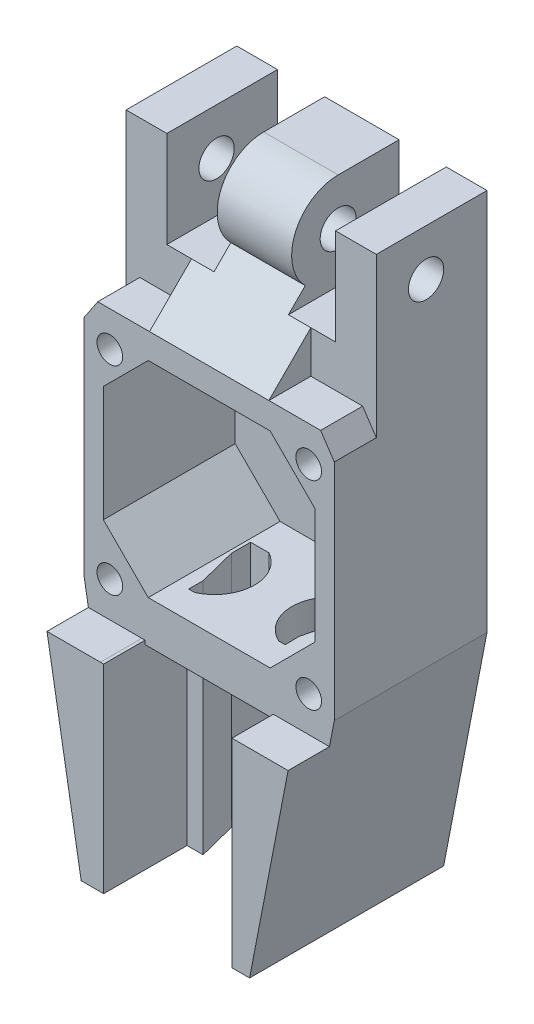
from build123d import *

# Parameters (mm, degrees)
SKETCH1_W                = 26
SKETCH1_H                = 28
BOSS_EXTRUDE1_DEPTH      = 50
CUT_EXTRUDE3_DEPTH       = 39
SKETCH14_R               = 7.25
BOSS_EXTRUDE7_DEPTH      = 5.8
SKETCH15_R               = 2.8
CUT_EXTRUDE4_DEPTH       = 28
CUT_EXTRUDE7_DEPTH       = 54.29223677
SKETCH19_R               = 2.15
CUT_EXTRUDE9_DEPTH       = 50
SKETCH20_R               = 4
CUT_EXTRUDE10_DEPTH      = 3
ESQUISSE1_W              = 17.371158736
ESQUISSE1_H              = 10.855066753
ENL_V_MAT_EXTRU_1_DEPTH  = 7.5
ESQUISSE2_R              = 1.7
ENL_V_MAT_EXTRU_2_DEPTH  = 7.5
ENL_V_START              = -7.2
ESQUISSE3_W              = 17.25
ESQUISSE3_H              = 8.423951408
ENL_V_MAT_EXTRU_3_DEPTH  = 7.2
ESQUISSE4_W              = 39
ESQUISSE4_H              = 42
BOSS_EXTRU_2_DEPTH       = 17.25
ESQUISSE5_W              = 29.115254442
ESQUISSE5_H              = 34.676509426
ENL_V_MAT_EXTRU_4_DEPTH  = 19
ESQUISSE6_R              = 3
ENL_V_MAT_EXTRU_5_DEPTH  = 19
ESQUISSE7_R              = 9.530246906
ENL_V_MAT_EXTRU_6_DEPTH  = 14
ENL_V_MAT_EXTRU_7_DEPTH  = 14
ESQUISSE10_W             = 39
ESQUISSE10_H             = 17.25
BOSS_EXTRU_5_DEPTH       = 31
ENL_V_MAT_EXTRU_9_DEPTH  = 32
ENL_V_START_2            = -17.25
ESQUISSE16_R             = 2
ENL_V_MAT_EXTRU_11_DEPTH = 17.25
ESQUISSE17_R             = 2.75
ENL_V_MAT_EXTRU_12_DEPTH = 9
ESQUISSE27_W             = 21
ESQUISSE27_H             = 3
BOSS_EXTRU_24_DEPTH      = 6.55
BOSS_EXTRU_7_DEPTH       = 17.25
ENL_V_MAT_EXTRU_14_DEPTH = 17.3
ENL_V_MAT_EXTRU_16_DEPTH = 17.25
ENL_V_MAT_EXTRU_38_DEPTH = 11
ENL_V_MAT_EXTRU_39_DEPTH = 5
BOSS_EXTRU_30_DEPTH      = 0.6
ESQUISSE45_R             = 2.15
ENL_V_MAT_EXTRU_40_DEPTH = 9
ESQUISSE40_R             = 2
BOSS_EXTRU_37_DEPTH      = 6.55
BOSS_EXTRU_35_DEPTH      = 17.25
BOSS_EXTRU_36_DEPTH      = 17.25
ESQUISSE50_R             = 2.75
ENL_V_MAT_EXTRU_42_DEPTH = 49
ESQUISSE52_W             = 15.002829597
ESQUISSE52_H             = 3.6
BOSS_EXTRU_38_DEPTH      = 6.55
ENL_V_START_3            = -10
ENL_V_MAT_EXTRU_43_DEPTH = 10
BOSS_EXTRU_39_DEPTH      = 13
ESQUISSE55_W             = 21
ESQUISSE55_H             = 0.60000033
BOSS_EXTRU_40_DEPTH      = 6.45
ESQUISSE61_W             = 20
ESQUISSE61_H             = 3.13607345
ENL_V_MAT_EXTRU_44_DEPTH = 6.45
BOSS_EXTRU_41_DEPTH      = 6.55


with BuildPart() as part:
    # Sketch1 → Boss-Extrude1 (new body)
    with BuildSketch(Plane(origin=(0, 0, 0), x_dir=(1, 0, 0), z_dir=(0, 1, 0))):
        Rectangle(SKETCH1_W, SKETCH1_H)
    extrude(amount=BOSS_EXTRUDE1_DEPTH)

    # Sketch7 → Cut-Extrude3 (cut)
    with BuildSketch(Plane(origin=(13, 0, 0), x_dir=(0, 0, -1), z_dir=(1, 0, 0))):
        with BuildLine():
            Line((4.5, 50), (-14, 50))
            Line((-14, 50), (-14, 24))
            Line((-14, 24), (-0.626524164, 37.373475836))
            ThreePointArc((-0.626524164, 37.373475836), (11.198126611, 39.725545115), (4.5, 49.75))
            Line((4.5, 49.75), (14, 49.75))
            Line((14, 49.75), (14, 50))
            Line((14, 50), (4.5, 50))
        make_face()
    extrude(amount=-CUT_EXTRUDE3_DEPTH, mode=Mode.SUBTRACT)

    # Sketch14 → Boss-Extrude7 (add, symmetric)
    with BuildSketch(Plane(origin=(0, 0, 0), x_dir=(0, 0, -1), z_dir=(1, 0, 0))):
        with Locations((4.5, 42.5)):
            Circle(SKETCH14_R)
    boss_extrude7 = extrude(amount=BOSS_EXTRUDE7_DEPTH, both=True)

    # Symétrie1: Boss-Extrude7 across plane
    add(boss_extrude7.mirror(Plane(origin=(0, 0, 0), x_dir=(0, 0, 1), z_dir=(1, 0, 0))))

    # Sketch15 → Cut-Extrude4 (cut)
    with BuildSketch(Plane(origin=(13, 0, 0), x_dir=(0, 0, -1), z_dir=(1, 0, 0))):
        with Locations((4.5, 42.5)):
            Circle(SKETCH15_R)
    extrude(amount=-CUT_EXTRUDE4_DEPTH, mode=Mode.SUBTRACT)

    # Sketch17 → Cut-Extrude7 (cut, through all)
    with BuildSketch(Plane.XZ):
        Polygon((-9.3, 3.25), (-13, 3.25), (-13, 14), (13, 14), (13, 3.25), (9.3, 3.25), (9.3, 9.8), (-9.3, 9.8), align=None)
    extrude(amount=-CUT_EXTRUDE7_DEPTH, mode=Mode.SUBTRACT)

    # Sketch19 → Cut-Extrude9 (cut)
    with BuildSketch(Plane(origin=(0, 0, -14), x_dir=(-1, 0, 0), z_dir=(0, 0, -1))):
        with Locations((0, 15)):
            Circle(SKETCH19_R)
    extrude(amount=-CUT_EXTRUDE9_DEPTH, mode=Mode.SUBTRACT)

    # Sketch20 → Cut-Extrude10 (cut)
    with BuildSketch(Plane(origin=(0, 0, -14), x_dir=(-1, 0, 0), z_dir=(0, 0, -1))):
        with Locations((0, 15)):
            Circle(SKETCH20_R)
    extrude(amount=-CUT_EXTRUDE10_DEPTH, mode=Mode.SUBTRACT)

    # Esquisse1 → Enlèv. mat.-Extru.1 (cut)
    with BuildSketch(Plane(origin=(0, 49.75, 0), x_dir=(1, 0, 0), z_dir=(0, 1, 0))):
        with Locations((-14.485579368, 9.927533377)):
            Rectangle(ESQUISSE1_W, ESQUISSE1_H)
    enl_v_mat_extru_1 = extrude(amount=-ENL_V_MAT_EXTRU_1_DEPTH, mode=Mode.SUBTRACT)

    # Symétrie3: Enlèv. mat.-Extru.1 across plane
    add(enl_v_mat_extru_1.mirror(Plane(origin=(0, 0, 0), x_dir=(0, 0, 1), z_dir=(1, 0, 0))), mode=Mode.SUBTRACT)

    # Esquisse2 → Enlèv. mat.-Extru.2 (cut)
    with BuildSketch(Plane.ZY.offset(13)):
        with Locations((-8, 14.2)):
            Circle(ESQUISSE2_R)
        with Locations((-3, 5.2)):
            Circle(ESQUISSE2_R)
    enl_v_mat_extru_2 = extrude(amount=-ENL_V_MAT_EXTRU_2_DEPTH, mode=Mode.SUBTRACT)

    # Symétrie2: Enlèv. mat.-Extru.2 across plane
    add(enl_v_mat_extru_2.mirror(Plane(origin=(0, 0, 0), x_dir=(0, 0, 1), z_dir=(1, 0, 0))), mode=Mode.SUBTRACT)

    # Esquisse3 → Enlèv. mat.-Extru.3 (cut)
    with BuildSketch(Plane(origin=(13, 0, 0), x_dir=(0, 0, -1), z_dir=(1, 0, 0)).offset(ENL_V_START)):
        with Locations((5.375, 38.961975704)):
            Rectangle(ESQUISSE3_W, ESQUISSE3_H)
    enl_v_mat_extru_3 = extrude(amount=ENL_V_MAT_EXTRU_3_DEPTH, mode=Mode.SUBTRACT)

    # Symétrie4: Enlèv. mat.-Extru.3 across plane
    add(enl_v_mat_extru_3.mirror(Plane(origin=(0, 0, 0), x_dir=(0, 0, 1), z_dir=(1, 0, 0))), mode=Mode.SUBTRACT)

    # Esquisse4 → Boss.-Extru.2 (add)
    with BuildSketch(Plane.XY.offset(3.25)):
        with Locations((0, 7.2)):
            Rectangle(ESQUISSE4_W, ESQUISSE4_H)
    extrude(amount=-BOSS_EXTRU_2_DEPTH)

    # Esquisse5 → Enlèv. mat.-Extru.4 (cut)
    with BuildSketch(Plane.XY.offset(3.25)):
        with Locations((1.557627221, 10.861745287)):
            Rectangle(ESQUISSE5_W, ESQUISSE5_H)
    extrude(amount=ENL_V_MAT_EXTRU_4_DEPTH, mode=Mode.SUBTRACT)

    # Esquisse6 → Enlèv. mat.-Extru.5 (cut)
    with BuildSketch(Plane.XY.offset(3.25)):
        with Locations((0, 7.2)):
            Circle(ESQUISSE6_R)
    extrude(amount=-ENL_V_MAT_EXTRU_5_DEPTH, mode=Mode.SUBTRACT)

    # Esquisse7 → Enlèv. mat.-Extru.6 (cut)
    with BuildSketch(Plane.XY.offset(3.25)):
        with Locations((0, 7.2)):
            Circle(ESQUISSE7_R)
    extrude(amount=-ENL_V_MAT_EXTRU_6_DEPTH, mode=Mode.SUBTRACT)

    # Esquisse8 → Enlèv. mat.-Extru.7 (cut)
    with BuildSketch(Plane.XY.offset(3.25)):
        Polygon((-9.5, 24.2), (9.5, 24.2), (16.5, 17.2), (16.5, -0.8), (9.5, -7.8), (-9.5, -7.8), (-16.5, -0.8), (-16.5, 17.2), align=None)
    extrude(amount=-ENL_V_MAT_EXTRU_7_DEPTH, mode=Mode.SUBTRACT)

    # Esquisse10 → Boss.-Extru.5 (add)
    with BuildSketch(Plane.XZ.offset(13.8)):
        with Locations((0, -5.375)):
            Rectangle(ESQUISSE10_W, ESQUISSE10_H)
    extrude(amount=BOSS_EXTRU_5_DEPTH)

    # Sketch3 → Enlèv. mat.-Extru.9 (cut)
    with BuildSketch(Plane(origin=(0, -13.8, 0), x_dir=(1, 0, 0), z_dir=(0, 1, 0))):
        Polygon((10, 2.65), (10, 9.65), (2.9, 9.65), (2.9, 5.65), (-2.9, 5.65), (-2.9, 9.65), (-10, 9.65), (-10, 2.65), (-9, 2.65), (-7.502829597, -3.25), (-10, -3.25), (-10, -14.961698536), (10, -14.961698536), (10, -3.25), (7.5, -3.25), (9, 2.65), align=None)
    extrude(amount=-ENL_V_MAT_EXTRU_9_DEPTH, mode=Mode.SUBTRACT)

    # Esquisse16 → Enlèv. mat.-Extru.11 (cut)
    with BuildSketch(Plane.XY.offset(3.25).offset(ENL_V_START_2)):
        with Locations((15.512108792, 22.7)):
            Circle(ESQUISSE16_R)
        with Locations((-15.487891208, 22.7)):
            Circle(ESQUISSE16_R)
        with Locations((15.512108792, -8.3)):
            Circle(ESQUISSE16_R)
        with Locations((-15.487891208, -8.3)):
            Circle(ESQUISSE16_R)
    extrude(amount=ENL_V_MAT_EXTRU_11_DEPTH, mode=Mode.SUBTRACT)

    # Esquisse17 → Enlèv. mat.-Extru.12 (cut)
    with BuildSketch(Plane(origin=(0, 0, -14), x_dir=(-1, 0, 0), z_dir=(0, 0, -1))):
        with Locations((-15.512108792, 22.7)):
            Circle(ESQUISSE17_R)
        with Locations((15.487891208, 22.7)):
            Circle(ESQUISSE17_R)
        with Locations((-15.512108792, -8.3)):
            Circle(ESQUISSE17_R)
        with Locations((15.487891208, -8.3)):
            Circle(ESQUISSE17_R)
    extrude(amount=-ENL_V_MAT_EXTRU_12_DEPTH, mode=Mode.SUBTRACT)

    # Esquisse27 → Boss.-Extru.24 (add)
    with BuildSketch(Plane.XY.offset(3.25)):
        with Locations((0, -12.9)):
            Rectangle(ESQUISSE27_W, ESQUISSE27_H)
    extrude(amount=BOSS_EXTRU_24_DEPTH)

    # Esquisse19 → Boss.-Extru.7 (add)
    with BuildSketch(Plane.XY.offset(3.25)):
        Polygon((-13, 34.75), (-19.5, 28.2), (-13, 28.2), align=None)
        Polygon((13, 34.75), (19.5, 28.2), (13, 28.2), align=None)
    extrude(amount=-BOSS_EXTRU_7_DEPTH)

    # Esquisse20 → Enlèv. mat.-Extru.14 (cut)
    with BuildSketch(Plane.XY.offset(3.25)):
        Polygon((-13, 34.75), (-19.5, 25), (-25.267044085, 25), (-36.830319762, 37.531631788), align=None)
    enl_v_mat_extru_14 = extrude(amount=-ENL_V_MAT_EXTRU_14_DEPTH, mode=Mode.SUBTRACT)

    # Symétrie5: Enlèv. mat.-Extru.14 across plane
    add(enl_v_mat_extru_14.mirror(Plane(origin=(0, 0, 0), x_dir=(0, 0, 1), z_dir=(1, 0, 0))), mode=Mode.SUBTRACT)

    # Esquisse23 → Enlèv. mat.-Extru.16 (cut)
    with BuildSketch(Plane.XY.offset(3.25).offset(ENL_V_START_2)):
        Polygon((-19.5, -9.9), (-13.501414798, -44.8), (-19.5, -53.715016997), (-34.841721145, -40.42179861), align=None)
        Polygon((19.5, -9.9), (12.75, -44.8), (15.434620089, -57.994993548), (31.637048755, -53.482911652), align=None)
    extrude(amount=ENL_V_MAT_EXTRU_16_DEPTH, mode=Mode.SUBTRACT)

    # Esquisse36 → Enlèv. mat.-Extru.38 (cut)
    with BuildSketch(Plane.XZ.offset(7.8)):
        with BuildLine():
            Line((9, -2.65), (9, -5.65))
            Line((9, -5.65), (6.149863907, -5.65))
            ThreePointArc((6.149863907, -5.65), (2.904031499, 0.044057116), (6.550876644, 5.489994589))
            Line((6.550876644, 5.489994589), (6.93050985, 5.489994589))
            Line((6.93050985, 5.489994589), (9, -2.65))
        make_face()
        with BuildLine():
            Line((-6.149863907, -5.65), (-9, -5.65))
            Line((-9, -5.65), (-9, -2.65))
            Line((-9, -2.65), (-6.934413732, 5.489994589))
            Line((-6.934413732, 5.489994589), (-6.550876644, 5.489994589))
            ThreePointArc((-6.550876644, 5.489994589), (-2.904031499, 0.044057116), (-6.149863907, -5.65))
        make_face()
    extrude(amount=ENL_V_MAT_EXTRU_38_DEPTH, mode=Mode.SUBTRACT)

    # Esquisse43 → Enlèv. mat.-Extru.39 (cut)
    with BuildSketch(Plane(origin=(0, -14.4, 0), x_dir=(-1, 0, 0), z_dir=(0, -1, 0))):
        Polygon((-6.93050985, -5.489994589), (-7.533514539, -5.489994589), (-7.5, -3.25), align=None)
        Polygon((7.502829597, -3.25), (7.502829597, -5.489994589), (6.934413732, -5.489994589), align=None)
    extrude(amount=-ENL_V_MAT_EXTRU_39_DEPTH, mode=Mode.SUBTRACT)

    # Esquisse44 → Boss.-Extru.30 (add)
    with BuildSketch(Plane.XZ.offset(13.8)):
        with BuildLine():
            Line((-9, -5.65), (-6.149863907, -5.65))
            ThreePointArc((-6.149863907, -5.65), (-3.085212662, -1.687593328), (-3.929562121, 3.25))
            Line((-3.929562121, 3.25), (3.929562121, 3.25))
            ThreePointArc((3.929562121, 3.25), (3.085212662, -1.687593328), (6.149863907, -5.65))
            Line((6.149863907, -5.65), (9, -5.65))
            Line((9, -5.65), (9, -2.65))
            Line((9, -2.65), (10, -2.65))
            Line((10, -2.65), (10, -9.65))
            Line((10, -9.65), (2.9, -9.65))
            Line((2.9, -9.65), (2.9, -5.65))
            Line((2.9, -5.65), (-2.9, -5.65))
            Line((-2.9, -5.65), (-2.9, -9.65))
            Line((-2.9, -9.65), (-10, -9.65))
            Line((-10, -9.65), (-10, -2.65))
            Line((-10, -2.65), (-9, -2.65))
            Line((-9, -2.65), (-9, -5.65))
        make_face()
    extrude(amount=BOSS_EXTRU_30_DEPTH)

    # Esquisse45 → Enlèv. mat.-Extru.40 (cut)
    with BuildSketch(Plane.XY.offset(-5.65)):
        with Locations((0, -24.4)):
            Circle(ESQUISSE45_R)
    extrude(amount=-ENL_V_MAT_EXTRU_40_DEPTH, mode=Mode.SUBTRACT)

    # Esquisse40 → Boss.-Extru.37 (add)
    with BuildSketch(Plane.XY.offset(3.25)):
        Polygon((17.36666519, 28.200002216), (-17.36666519, 28.200002216), (-19.5, 25), (-19.5, -9.9), (-19.242181152, -11.4), (-10.5, -11.4), (-7.502829597, -11.4), (-7.502829597, -7.8), (-9.5, -7.8), (-16.5, -0.8), (-16.5, 17.2), (-9.5, 24.2), (9.5, 24.2), (16.5, 17.2), (16.5, -0.8), (9.5, -7.8), (7.5, -7.8), (7.5, -11.4), (10.5, -11.4), (19.209885387, -11.4), (19.5, -9.9), (19.5, 25), align=None)
        with Locations((-15.487891208, 22.7)):
            Circle(ESQUISSE40_R, mode=Mode.SUBTRACT)
        with Locations((-15.487891208, -8.3)):
            Circle(ESQUISSE40_R, mode=Mode.SUBTRACT)
        with Locations((15.512108792, -8.3)):
            Circle(ESQUISSE40_R, mode=Mode.SUBTRACT)
        with Locations((15.512108792, 22.7)):
            Circle(ESQUISSE40_R, mode=Mode.SUBTRACT)
    extrude(amount=BOSS_EXTRU_37_DEPTH)

    # Esquisse48 → Boss.-Extru.35 (add)
    with BuildSketch(Plane.XY.offset(3.25)):
        Polygon((13.15, 34.75), (13.15, 49.75), (19.5, 49.75), (19.5, 25), (13, 34.75), align=None)
    extrude(amount=-BOSS_EXTRU_35_DEPTH)

    # Esquisse51 → Boss.-Extru.36 (add)
    with BuildSketch(Plane.XY.offset(3.25)):
        Polygon((-19.5, 25), (-19.5, 49.75), (-13.15, 49.75), (-13.15, 34.75), (-13, 34.75), align=None)
    extrude(amount=-BOSS_EXTRU_36_DEPTH)

    # Esquisse50 → Enlèv. mat.-Extru.42 (cut)
    with BuildSketch(Plane(origin=(19.5, 0, 0), x_dir=(0, 0, -1), z_dir=(1, 0, 0))):
        with Locations(Location((4.5, 42.5, 0), (0, 0, 90))):
            Circle(ESQUISSE50_R)
    extrude(amount=-ENL_V_MAT_EXTRU_42_DEPTH, mode=Mode.SUBTRACT)

    # Esquisse52 → Boss.-Extru.38 (add)
    with BuildSketch(Plane.XY.offset(9.8)):
        with Locations((-0.001414798, -9.6)):
            Rectangle(ESQUISSE52_W, ESQUISSE52_H)
    extrude(amount=-BOSS_EXTRU_38_DEPTH)

    # Esquisse53 → Enlèv. mat.-Extru.43 (cut)
    with BuildSketch(Plane.XZ.offset(11.4).offset(ENL_V_START_3)):
        with BuildLine():
            Line((7.5, 3.25), (7.533514539, 5.489994589))
            Line((7.533514539, 5.489994589), (6.550876644, 5.489994589))
            ThreePointArc((6.550876644, 5.489994589), (5.082122349, 4.555007585), (3.929562121, 3.25))
            Line((3.929562121, 3.25), (7.5, 3.25))
        make_face()
        with BuildLine():
            Line((-7.502829597, 5.489994589), (-6.550876644, 5.489994589))
            ThreePointArc((-6.550876644, 5.489994589), (-5.082122349, 4.555007585), (-3.929562121, 3.25))
            Line((-3.929562121, 3.25), (-7.502829597, 3.25))
            Line((-7.502829597, 3.25), (-7.502829597, 5.489994589))
        make_face()
    extrude(amount=ENL_V_MAT_EXTRU_43_DEPTH, mode=Mode.SUBTRACT)

    # Esquisse54 → Boss.-Extru.39 (add)
    with BuildSketch(Plane.XY.offset(3.25)):
        Polygon((-10.5, -13.79999967), (-18.829671445, -13.799997383), (-13.501414798, -44.8), (-10, -44.8), (-10, -14.4), (-10.5, -14.4), align=None)
        Polygon((10, -14.4), (10.5, -14.4), (10.5, -13.799997784), (18.745702434, -13.799997784), (12.75, -44.8), (10, -44.8), align=None)
    extrude(amount=BOSS_EXTRU_39_DEPTH)

    # Esquisse55 → Boss.-Extru.40 (add)
    with BuildSketch(Plane.XY.offset(9.8)):
        with Locations((0, -14.099999835)):
            Rectangle(ESQUISSE55_W, ESQUISSE55_H)
    extrude(amount=BOSS_EXTRU_40_DEPTH)

    # Esquisse61 → Enlèv. mat.-Extru.44 (cut)
    with BuildSketch(Plane.XY.offset(16.25)):
        with Locations((0, -12.831963275)):
            Rectangle(ESQUISSE61_W, ESQUISSE61_H)
    extrude(amount=-ENL_V_MAT_EXTRU_44_DEPTH, mode=Mode.SUBTRACT)

    # Esquisse63 → Boss.-Extru.41 (add)
    with BuildSketch(Plane.XY.offset(3.25)):
        Polygon((18.745702434, -13.799997784), (19.209885387, -11.4), (10.5, -11.4), (10.5, -13.799997784), align=None)
        Polygon((-10.5, -13.79999967), (-10.5, -11.4), (-19.242181152, -11.4), (-18.829671445, -13.799997383), align=None)
    extrude(amount=BOSS_EXTRU_41_DEPTH)


solid = part.part
